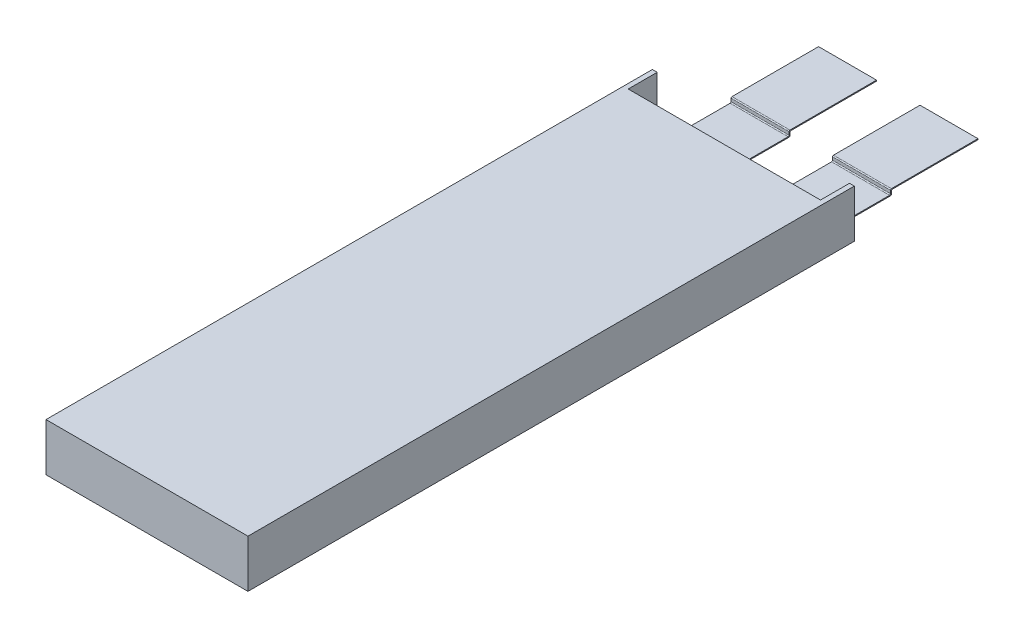
from build123d import *

# Parameters (mm, degrees)
SKETCH1_W           = 41.8
SKETCH1_H           = 125.5
BOSS_EXTRUDE1_DEPTH = 1
SKETCH2_W           = 41.8
SKETCH2_H           = 119.5
BOSS_EXTRUDE2_DEPTH = 8.9
SKETCH3_W           = 1
SKETCH3_H           = 6
BOSS_EXTRUDE3_DEPTH = 8.9
BOSS_EXTRUDE4_START = 4.5
BOSS_EXTRUDE4_DEPTH = 12


with BuildPart() as part:
    # Sketch1 → Boss-Extrude1 (new body)
    with BuildSketch(Plane(origin=(0, 0, 0), x_dir=(1, 0, 0), z_dir=(0, 1, 0))):
        Rectangle(SKETCH1_W, SKETCH1_H)
    extrude(amount=BOSS_EXTRUDE1_DEPTH)

    # Sketch2 → Boss-Extrude2 (add)
    with BuildSketch(Plane(origin=(0, 1, 0), x_dir=(1, 0, 0), z_dir=(0, 1, 0))):
        with Locations((0, -3)):
            Rectangle(SKETCH2_W, SKETCH2_H)
    extrude(amount=BOSS_EXTRUDE2_DEPTH)

    # Sketch3 → Boss-Extrude3 (add)
    with BuildSketch(Plane(origin=(0, 1, 0), x_dir=(1, 0, 0), z_dir=(0, 1, 0))):
        with Locations((-20.4, 59.75)):
            Rectangle(SKETCH3_W, SKETCH3_H)
    boss_extrude3 = extrude(amount=BOSS_EXTRUDE3_DEPTH)

    # Sketch4 → Boss-Extrude4 (add)
    with BuildSketch(Plane(origin=(0, 0, 0), x_dir=(0, 0, -1), z_dir=(1, 0, 0)).offset(BOSS_EXTRUDE4_START)):
        with BuildLine():
            Line((74.837571994, 1.2), (92.75, 1.2))
            Line((92.75, 1.2), (92.75, 1))
            Line((92.75, 1), (75.037571994, 1))
            ThreePointArc((75.037571994, 1), (74.896150637, 0.941421356), (74.837571994, 0.8))
            Line((74.837571994, 0.8), (74.837571994, 0.2))
            ThreePointArc((74.837571994, 0.2), (74.77899335, 0.058578644), (74.637571994, 0))
            Line((74.637571994, 0), (62.75, 0))
            Line((62.75, 0), (62.75, 0.2))
            Line((62.75, 0.2), (74.437571994, 0.2))
            ThreePointArc((74.437571994, 0.2), (74.57899335, 0.258578644), (74.637571994, 0.4))
            Line((74.637571994, 0.4), (74.637571994, 1))
            ThreePointArc((74.637571994, 1), (74.696150637, 1.141421356), (74.837571994, 1.2))
        make_face()
    boss_extrude4 = extrude(amount=BOSS_EXTRUDE4_DEPTH)

    # Mirror1: Boss-Extrude3, Boss-Extrude4 across plane
    add(boss_extrude3.mirror(Plane(origin=(0, 0, 0), x_dir=(0, 0, 1), z_dir=(1, 0, 0))))
    add(boss_extrude4.mirror(Plane(origin=(0, 0, 0), x_dir=(0, 0, 1), z_dir=(1, 0, 0))))


solid = part.part
